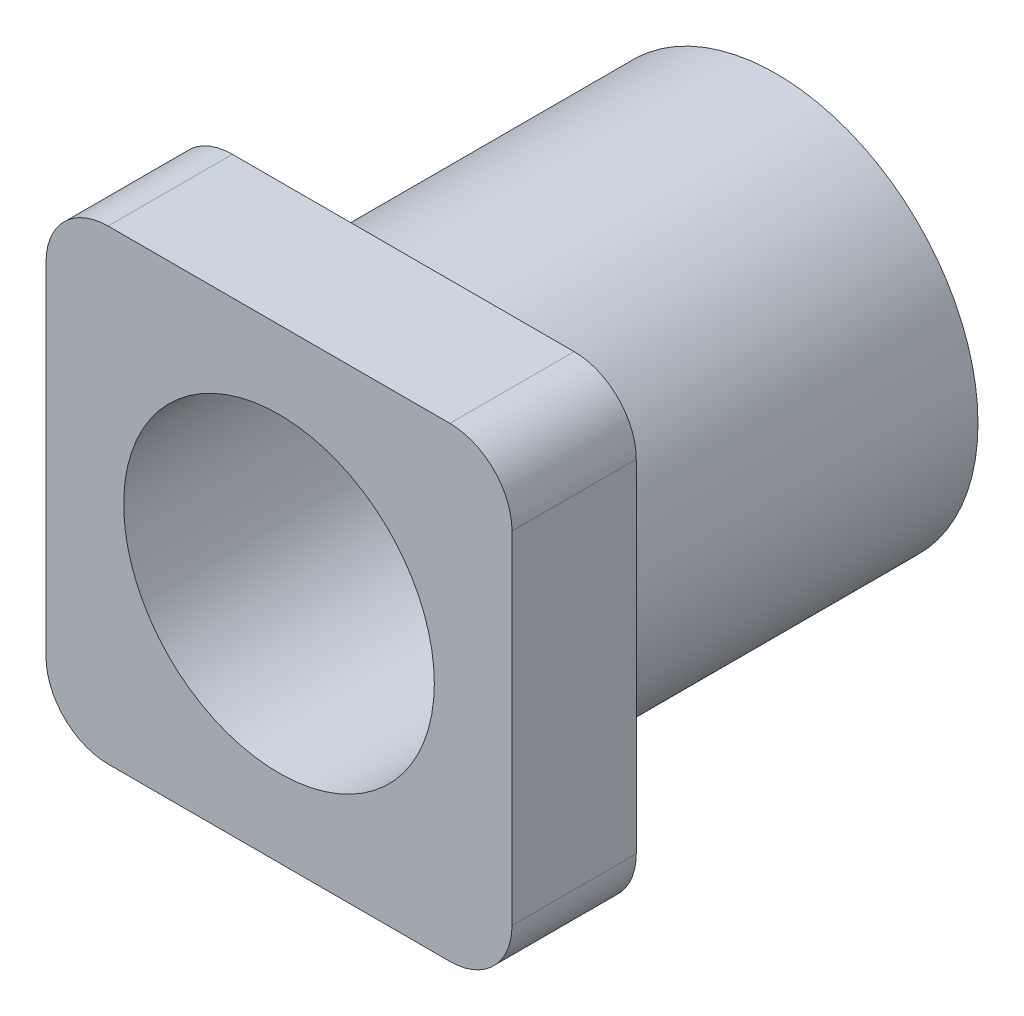
from build123d import *

# Parameters (mm, degrees)
SKETCH1_W           = 19.05
SKETCH1_H           = 19.05
BOSS_EXTRUDE1_DEPTH = 5.08
SKETCH2_R           = 8.255
BOSS_EXTRUDE2_DEPTH = 15.24
SKETCH3_R           = 6.35
CUT_EXTRUDE1_DEPTH  = 25.379369352
FILLET1_R           = 2.54


with BuildPart() as part:
    # Sketch1 → Boss-Extrude1 (new body)
    with BuildSketch(Plane.XY):
        Rectangle(SKETCH1_W, SKETCH1_H)
    extrude(amount=-BOSS_EXTRUDE1_DEPTH)

    # Sketch2 → Boss-Extrude2 (add)
    with BuildSketch(Plane(origin=(0, 0, -5.08), x_dir=(-1, 0, 0), z_dir=(0, 0, -1))):
        with Locations(Location((0, 0, 0), (0, 0, 180))):
            Circle(SKETCH2_R)
    extrude(amount=BOSS_EXTRUDE2_DEPTH)

    # Sketch3 → Cut-Extrude1 (cut, through all)
    with BuildSketch(Plane.XY):
        Circle(SKETCH3_R)
    extrude(amount=-CUT_EXTRUDE1_DEPTH, mode=Mode.SUBTRACT)

    # Fillet1
    fillet1_edges = [part.edges().sort_by_distance(p)[0] for p in [
        (9.525, -9.525, -2.54),
        (-9.525, -9.525, -2.54),
        (-9.525, 9.525, -2.54),
        (9.525, 9.525, -2.54),
    ]]
    fillet(fillet1_edges, radius=FILLET1_R)


solid = part.part
